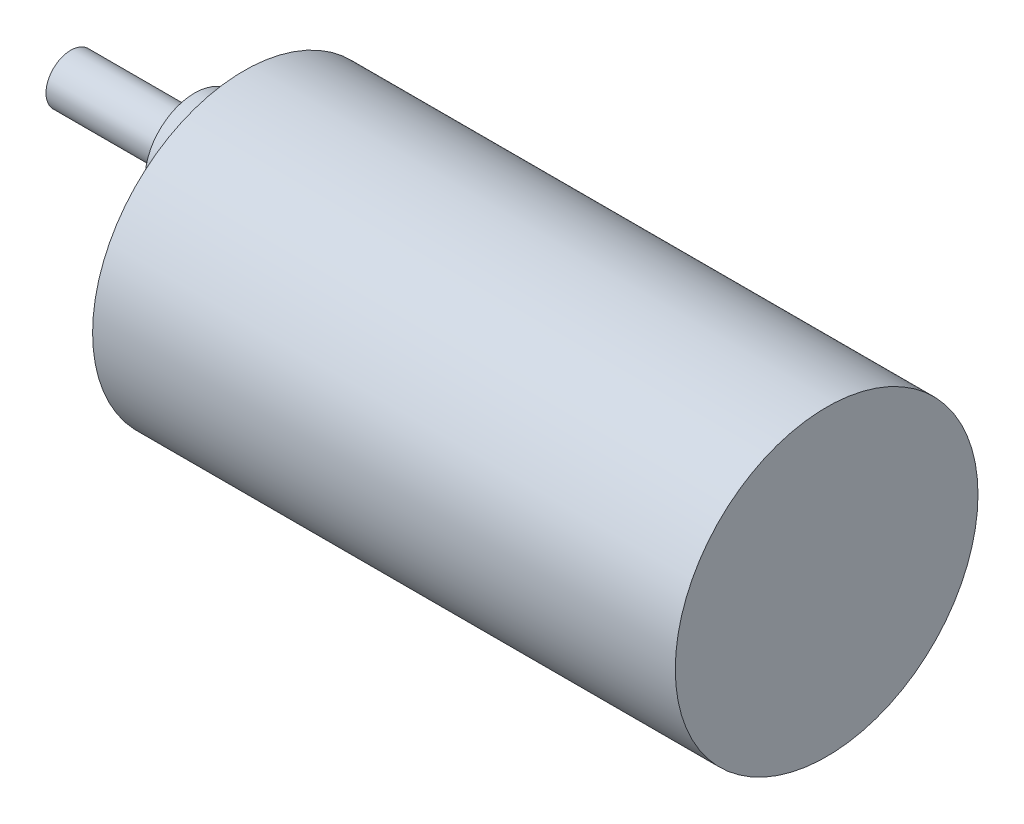
from build123d import *

# Parameters (mm, degrees)
ESQUISSE1_R             = 18.35
BOSS_EXTRU_1_DEPTH      = 70.64
ESQUISSE11_R            = 1.6
ENL_V_MAT_EXTRU_1_DEPTH = 10
ESQUISSE12_R            = 3
BOSS_EXTRU_2_DEPTH      = 21
ESQUISSE13_R            = 6
BOSS_EXTRU_3_DEPTH      = 6
ENL_V_START             = -11.8
ENL_V_MAT_EXTRU_2_DEPTH = 11.8


with BuildPart() as part:
    # Esquisse1 → Boss.-Extru.1 (new body)
    with BuildSketch(Plane(origin=(0, 0, 0), x_dir=(0, 0, -1), z_dir=(1, 0, 0))):
        Circle(ESQUISSE1_R)
    extrude(amount=BOSS_EXTRU_1_DEPTH)

    # Esquisse11 → Enlèv. mat.-Extru.1 (cut)
    with BuildSketch(Plane.ZY):
        with Locations((0, -15.5)):
            Circle(ESQUISSE11_R)
        with Locations((-7.75, -13.423393759)):
            Circle(ESQUISSE11_R)
        with Locations((-15.5, 0)):
            Circle(ESQUISSE11_R)
        with Locations((-13.423393759, 7.75)):
            Circle(ESQUISSE11_R)
        with Locations((-7.75, 13.423393759)):
            Circle(ESQUISSE11_R)
        with Locations((7.75, 13.423393759)):
            Circle(ESQUISSE11_R)
        with Locations((13.423393759, 7.75)):
            Circle(ESQUISSE11_R)
        with Locations((15.5, 0)):
            Circle(ESQUISSE11_R)
        with Locations((7.75, -13.423393759)):
            Circle(ESQUISSE11_R)
    extrude(amount=-ENL_V_MAT_EXTRU_1_DEPTH, mode=Mode.SUBTRACT)

    # Esquisse12 → Boss.-Extru.2 (add)
    with BuildSketch(Plane.ZY):
        with Locations(Location((0, 7, 0), (0, 0, 180))):
            Circle(ESQUISSE12_R)
    extrude(amount=BOSS_EXTRU_2_DEPTH)

    # Esquisse13 → Boss.-Extru.3 (add)
    with BuildSketch(Plane.ZY):
        with Locations(Location((0, 7, 0), (0, 0, 180))):
            Circle(ESQUISSE13_R)
    extrude(amount=BOSS_EXTRU_3_DEPTH)

    # Esquisse14 → Enlèv. mat.-Extru.2 (cut)
    with BuildSketch(Plane.ZY.offset(21).offset(ENL_V_START)):
        with BuildLine():
            Line((-1.307669683, 4.3), (1.307669683, 4.3))
            ThreePointArc((1.307669683, 4.3), (0, 4), (-1.307669683, 4.3))
        make_face()
    extrude(amount=ENL_V_MAT_EXTRU_2_DEPTH, mode=Mode.SUBTRACT)


solid = part.part
